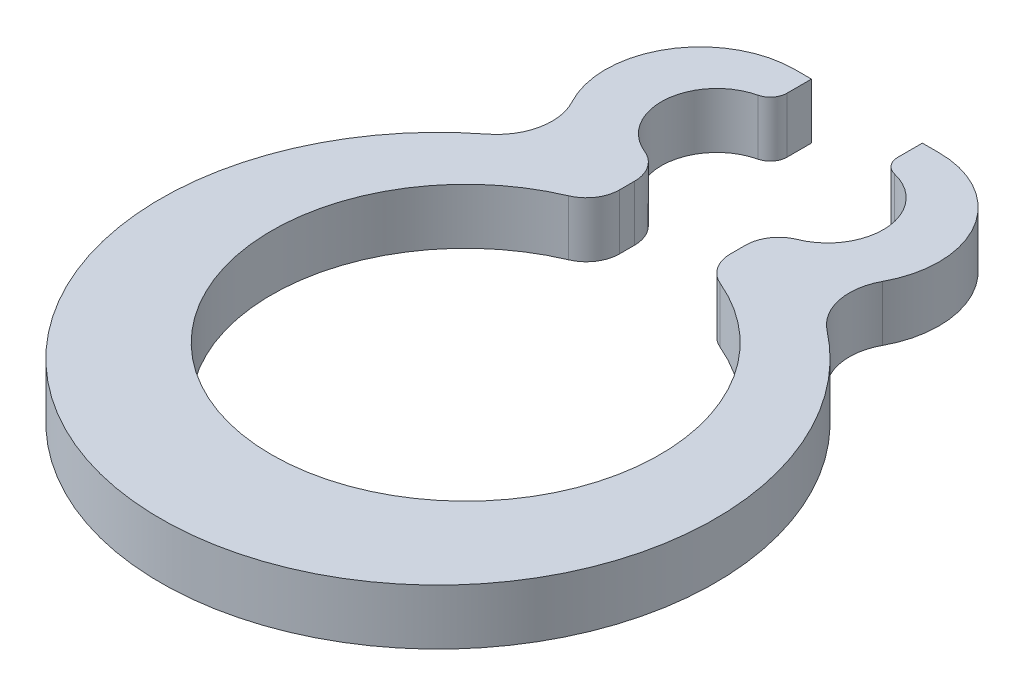
from build123d import *

# Parameters (mm, degrees)
EXTRUDE_1_DEPTH = 0.5


with BuildPart() as part:
    # Эскиз1 → Бобышка-Вытянуть1 (new body)
    with BuildSketch(Plane(origin=(0, 0, 0), x_dir=(1, 0, 0), z_dir=(0, 1, 0))):
        with BuildLine():
            Line((-0.5, 3.39653489), (-0.5, 3.617269734))
            Line((-0.5, 3.617269734), (-0.65, 3.617269734))
            ThreePointArc((-0.65, 3.617269734), (-1.383018397, 3.200677396), (-1.400206292, 2.357724418))
            ThreePointArc((-1.400206292, 2.357724418), (-1.350536641, 2.016782346), (-1.533211621, 1.724654938))
            ThreePointArc((-1.533211621, 1.724654938), (0, -2.75), (1.533211621, 1.724654938))
            ThreePointArc((1.533211621, 1.724654938), (1.350536641, 2.016782346), (1.400206292, 2.357724418))
            ThreePointArc((1.400206292, 2.357724418), (1.383018397, 3.200677396), (0.65, 3.617269734))
            Line((0.65, 3.617269734), (0.5, 3.617269734))
            Line((0.5, 3.617269734), (0.5, 3.39653489))
            ThreePointArc((0.5, 3.39653489), (0.532330319, 3.303508839), (0.615384615, 3.250583613))
            ThreePointArc((0.615384615, 3.250583613), (0.998565629, 2.801925275), (0.6875, 2.300566953))
            ThreePointArc((0.6875, 2.300566953), (0.551253141, 2.190164608), (0.5, 2.022459509))
            Line((0.5, 2.022459509), (0.5, 1.887458609))
            ThreePointArc((0.5, 1.887458609), (0.549878079, 1.72181132), (0.682926829, 1.611245154))
            ThreePointArc((0.682926829, 1.611245154), (0, -1.75), (-0.682926829, 1.611245154))
            ThreePointArc((-0.682926829, 1.611245154), (-0.549878079, 1.72181132), (-0.5, 1.887458609))
            Line((-0.5, 1.887458609), (-0.5, 2.022459509))
            ThreePointArc((-0.5, 2.022459509), (-0.551253141, 2.190164608), (-0.6875, 2.300566953))
            ThreePointArc((-0.6875, 2.300566953), (-0.998565629, 2.801925275), (-0.615384615, 3.250583613))
            ThreePointArc((-0.615384615, 3.250583613), (-0.532330319, 3.303508839), (-0.5, 3.39653489))
        make_face()
    extrude(amount=EXTRUDE_1_DEPTH)


solid = part.part
